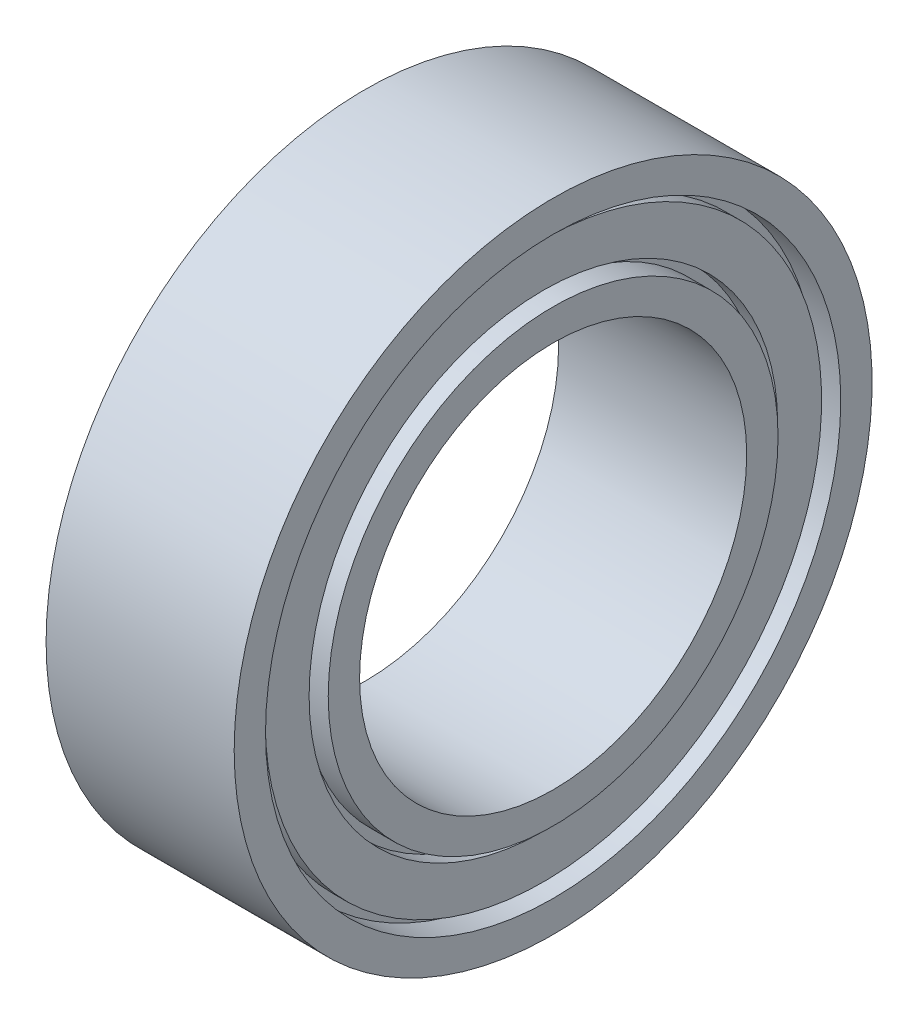
from build123d import *


with BuildPart() as part:
    # Sketch1 → Revolve1 (revolve)
    with BuildSketch(Plane.XY, mode=Mode.PRIVATE) as revolve1_sk:
        Polygon((-1.5, 3.087093808), (1.5, 3.087093808), (1.5, 3.587093808), (1.1, 3.587093808), (1.1, 3.737093808), (1.344796779, 3.737093808), (1.344796779, 4.437093808), (1.1, 4.437093808), (1.1, 4.587093808), (1.5, 4.587093808), (1.5, 5.087093808), (-1.5, 5.087093808), (-1.5, 4.587093808), (-1.1, 4.587093808), (-1.1, 4.437093808), (-1.344796779, 4.437093808), (-1.344796779, 3.737093808), (-1.1, 3.737093808), (-1.1, 3.587093808), (-1.5, 3.587093808), align=None)
    revolve(revolve1_sk.sketch.rotate(Axis((-2.67919432, 0, 0), (1, 0, 0)), 90), axis=Axis((-2.67919432, 0, 0), (1, 0, 0)))


solid = part.part
